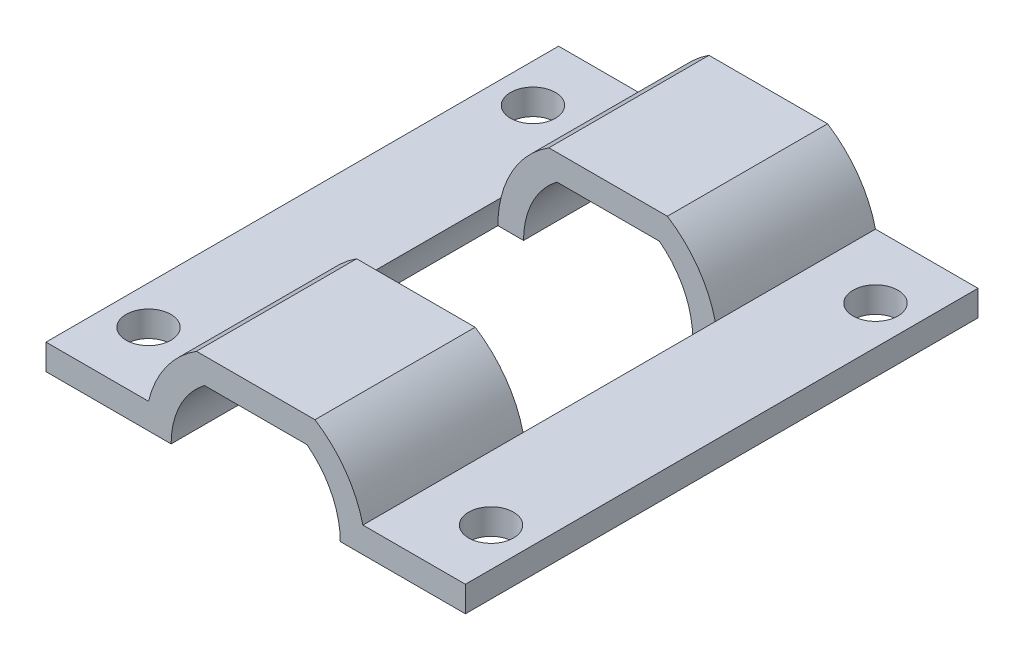
from build123d import *

# Parameters (mm, degrees)
BOSS_EXTRUDE1_DEPTH   = 20
BOSS_EXTRUDE1_2_DEPTH = 20
BOSS_EXTRUDE2_DEPTH   = 20
CUT_EXTRUDE1_DEPTH    = 7.5
SKETCH3_R             = 1.75
CUT_EXTRUDE2_DEPTH    = 27.369487129


with BuildPart() as part:
    # Sketch2 → Boss-Extrude1 (new, symmetric)
    with BuildSketch(Plane.XY):
        with BuildLine():
            Line((-16.364209467, 0), (-8.6, 0))
            ThreePointArc((-8.6, 0), (-8.540848945, 1.006925665), (-8.364209467, 2))
            Line((-8.364209467, 2), (-16.364209467, 2))
            Line((-16.364209467, 2), (-16.364209467, 0))
        make_face()
    extrude(amount=BOSS_EXTRUDE1_DEPTH, both=True)



with BuildPart() as body_2:
    # Sketch2 → Boss-Extrude1 2 (new, symmetric)
    with BuildSketch(Plane.XY):
        with BuildLine():
            ThreePointArc((8.364209467, 2), (8.540848945, 1.006925665), (8.6, 0))
            Line((8.6, 0), (16.364209467, 0))
            Line((16.364209467, 0), (16.364209467, 2))
            Line((16.364209467, 2), (8.364209467, 2))
        make_face()
    extrude(amount=BOSS_EXTRUDE1_2_DEPTH, both=True)


with BuildPart() as part_1:
    add(part.part)

    add(body_2.part)  # Boss-Extrude2 merges body 2
    # Sketch2<4> → Boss-Extrude2 (add, symmetric)
    with BuildSketch(Plane.XY):
        with BuildLine():
            Line((-8.6, 0), (-6.6, 0))
            ThreePointArc((-6.6, 0), (-5.914302048, 2.929339736), (-3.999687488, 5.25))
            Line((-3.999687488, 5.25), (3.999687488, 5.25))
            ThreePointArc((3.999687488, 5.25), (5.914302048, 2.929339736), (6.6, 0))
            Line((6.6, 0), (8.6, 0))
            ThreePointArc((8.6, 0), (8.540848945, 1.006925665), (8.364209467, 2))
            ThreePointArc((8.364209467, 2), (7.005379537, 4.988452419), (4.625743184, 7.25))
            Line((4.625743184, 7.25), (-4.625743184, 7.25))
            ThreePointArc((-4.625743184, 7.25), (-7.005379537, 4.988452419), (-8.364209467, 2))
            ThreePointArc((-8.364209467, 2), (-8.540848945, 1.006925665), (-8.6, 0))
        make_face()
    extrude(amount=BOSS_EXTRUDE2_DEPTH, both=True)

    # Sketch2<5> → Cut-Extrude1 (cut, symmetric)
    with BuildSketch(Plane.XY):
        with BuildLine():
            Line((-8.6, 0), (-6.6, 0))
            ThreePointArc((-6.6, 0), (-5.914302048, 2.929339736), (-3.999687488, 5.25))
            Line((-3.999687488, 5.25), (3.999687488, 5.25))
            ThreePointArc((3.999687488, 5.25), (5.914302048, 2.929339736), (6.6, 0))
            Line((6.6, 0), (8.6, 0))
            ThreePointArc((8.6, 0), (8.540848945, 1.006925665), (8.364209467, 2))
            ThreePointArc((8.364209467, 2), (7.005379537, 4.988452419), (4.625743184, 7.25))
            Line((4.625743184, 7.25), (-4.625743184, 7.25))
            ThreePointArc((-4.625743184, 7.25), (-7.005379537, 4.988452419), (-8.364209467, 2))
            ThreePointArc((-8.364209467, 2), (-8.540848945, 1.006925665), (-8.6, 0))
        make_face()
    extrude(amount=CUT_EXTRUDE1_DEPTH, both=True, mode=Mode.SUBTRACT)

    # Sketch3 → Cut-Extrude2 (cut, through all)
    with BuildSketch(Plane(origin=(0, 2, 0), x_dir=(1, 0, 0), z_dir=(0, 1, 0))):
        with Locations((-13.364209467, 15)):
            Circle(SKETCH3_R)
        with Locations((-13.364209467, -15)):
            Circle(SKETCH3_R)
    cut_extrude2 = extrude(amount=-CUT_EXTRUDE2_DEPTH, mode=Mode.SUBTRACT)

    # Mirror1: Cut-Extrude2 across plane
    add(cut_extrude2.mirror(Plane(origin=(0, 0, 0), x_dir=(0, 0, 1), z_dir=(1, 0, 0))), mode=Mode.SUBTRACT)


solid = part_1.part
